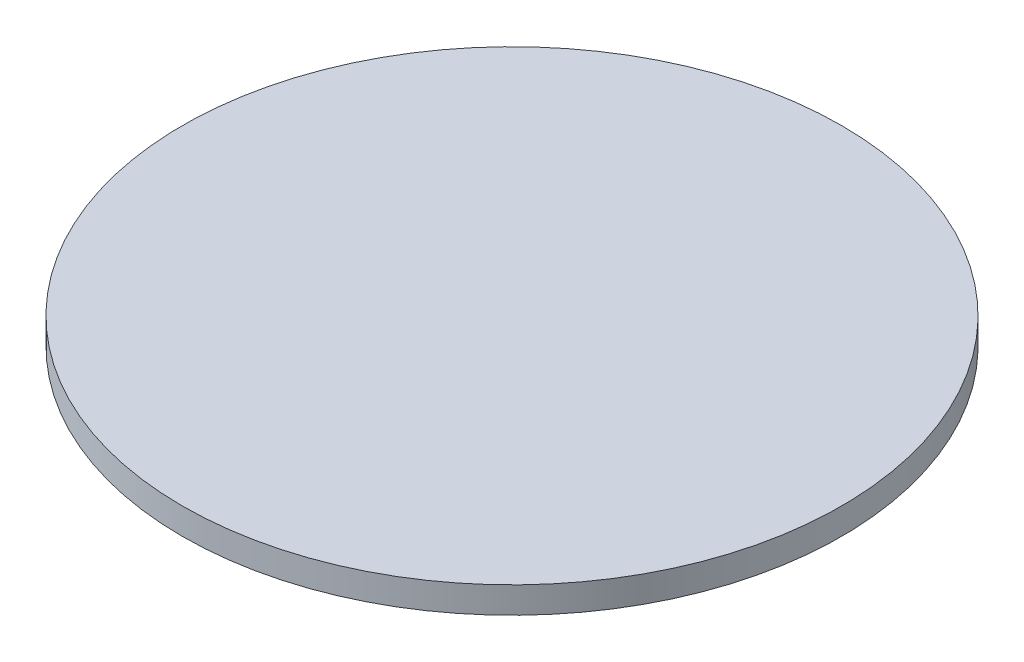
from build123d import *

# Parameters (mm, degrees)
SKETCH1_R           = 5
BOSS_EXTRUDE1_DEPTH = 0.4


with BuildPart() as part:
    # Sketch1 → Boss-Extrude1 (new body)
    with BuildSketch(Plane(origin=(0, 0, 0), x_dir=(1, 0, 0), z_dir=(0, 1, 0))):
        with Locations(Location((0, 0, 0), (0, 0, 270))):
            Circle(SKETCH1_R)
    extrude(amount=BOSS_EXTRUDE1_DEPTH)


solid = part.part
